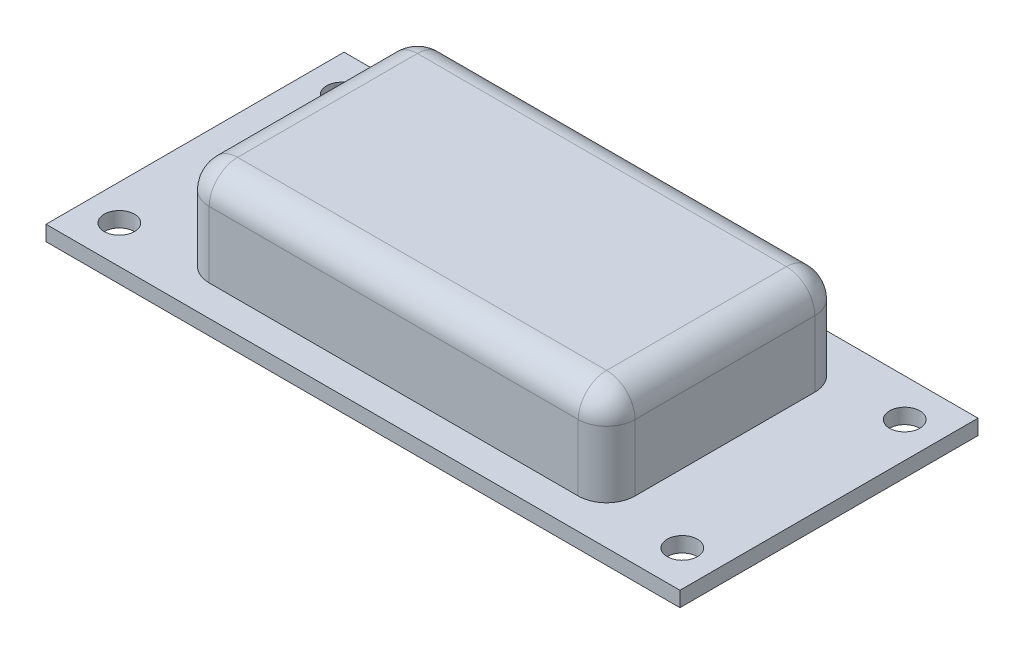
from build123d import *

# Parameters (mm, degrees)
SKETCH_1_W      = 67
SKETCH_1_H      = 31.5
SKETCH_1_R      = 1.6
EXTRUDE_1_DEPTH = 1.6
SKETCH_2_W      = 45
SKETCH_2_H      = 25
EXTRUDE_2_DEPTH = 10
FILLET_1_R      = 3


with BuildPart() as part:
    # 草圖1 → 填料-伸長1 (new body)
    with BuildSketch(Plane(origin=(0, 0, 0), x_dir=(1, 0, 0), z_dir=(0, 1, 0))):
        Rectangle(SKETCH_1_W, SKETCH_1_H)
        with Locations(Location((-29.75, 11.75, 0), (0, 0, 270))):
            Circle(SKETCH_1_R, mode=Mode.SUBTRACT)
        with Locations(Location((-29.75, -11.75, 0), (0, 0, 270))):
            Circle(SKETCH_1_R, mode=Mode.SUBTRACT)
        with Locations(Location((29.75, -11.75, 0), (0, 0, 270))):
            Circle(SKETCH_1_R, mode=Mode.SUBTRACT)
        with Locations(Location((29.75, 11.75, 0), (0, 0, 270))):
            Circle(SKETCH_1_R, mode=Mode.SUBTRACT)
    extrude(amount=EXTRUDE_1_DEPTH)

    # 草圖2 → 填料-伸長2 (add)
    with BuildSketch(Plane(origin=(0, 1.6, 0), x_dir=(1, 0, 0), z_dir=(0, 1, 0))):
        Rectangle(SKETCH_2_W, SKETCH_2_H)
    extrude(amount=EXTRUDE_2_DEPTH)

    # 圓角1
    fillet_1_edges = [part.edges().sort_by_distance(p)[0] for p in [
        (22.5, 6.6, 12.5),
        (22.5, 6.6, -12.5),
        (-22.5, 6.6, -12.5),
        (-22.5, 6.6, 12.5),
        (22.5, 11.6, 0),
        (0, 11.6, -12.5),
        (-22.5, 11.6, 0),
        (0, 11.6, 12.5),
    ]]
    fillet(fillet_1_edges, radius=FILLET_1_R)


solid = part.part
